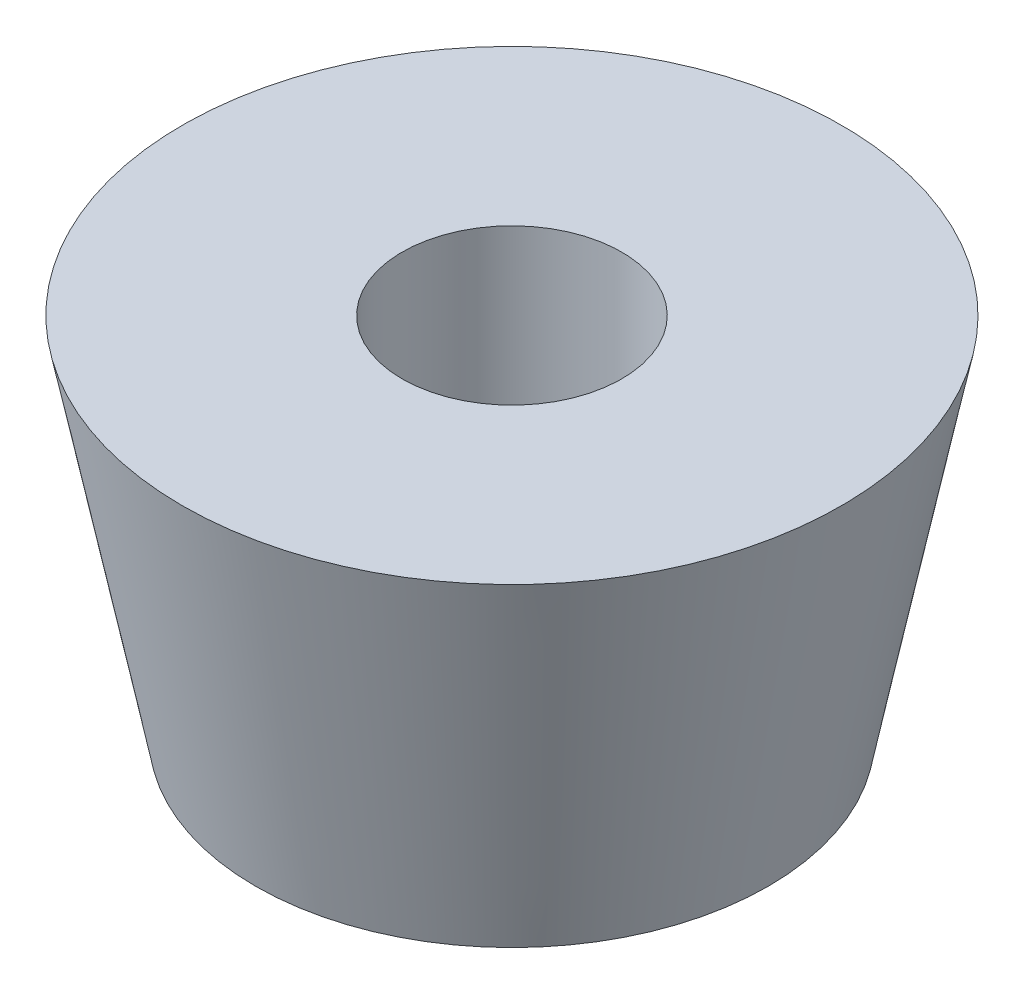
from build123d import *


with BuildPart() as part:
    # Sketch1 → Revolve1 (revolve)
    with BuildSketch(Plane(origin=(0, 0, 0), x_dir=(0, 0, -1), z_dir=(1, 0, 0)), mode=Mode.PRIVATE) as revolve1_sk:
        Polygon((1.5, 0), (1.5, -5), (3.5, -5), (4.5, 0), align=None)
    revolve(revolve1_sk.sketch.rotate(Axis((0, 0, 0), (0, -1, 0)), 180), axis=Axis((0, 0, 0), (0, -1, 0)))


solid = part.part
